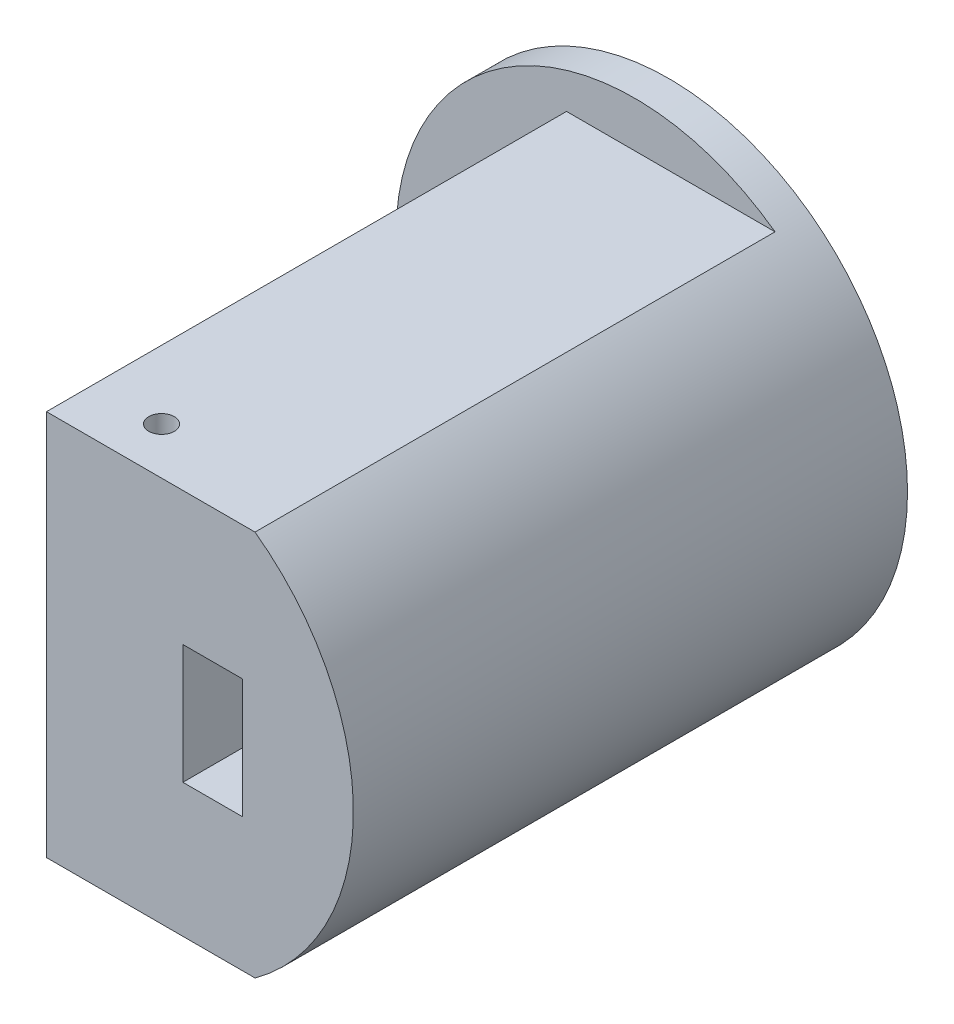
from build123d import *

# Parameters (mm, degrees)
SKETCH2_R           = 14
BOSS_EXTRUDE1_DEPTH = 2
SKETCH1_W           = 8
SKETCH1_H           = 22.649954628
SKETCH1_W_2         = 6
SKETCH1_H_2         = 18.4
BOSS_EXTRUDE2_DEPTH = 25
SKETCH3_W           = 8
SKETCH3_H           = 22.649954628
BOSS_EXTRUDE3_DEPTH = 5.5
SKETCH4_W           = 6
SKETCH4_H           = 18.4
CUT_EXTRUDE1_DEPTH  = 37.362755671
SKETCH5_W           = 5
SKETCH5_H           = 18.4
CUT_EXTRUDE2_DEPTH  = 40.258756985
SKETCH7_R           = 0.75
CUT_EXTRUDE3_DEPTH  = 44.515565904
BOSS_EXTRUDE4_DEPTH = 30.5
SKETCH9_W           = 3.5
SKETCH9_H           = 7
CUT_EXTRUDE4_DEPTH  = 6


with BuildPart() as part:
    # Sketch2 → Boss-Extrude1 (new body)
    with BuildSketch(Plane.XY):
        Circle(SKETCH2_R)
    extrude(amount=BOSS_EXTRUDE1_DEPTH)

    # Sketch1 → Boss-Extrude2 (add)
    with BuildSketch(Plane.XY.offset(2)):
        Rectangle(SKETCH1_W, SKETCH1_H)
        Rectangle(SKETCH1_W_2, SKETCH1_H_2, mode=Mode.SUBTRACT)
    extrude(amount=BOSS_EXTRUDE2_DEPTH)

    # Sketch3 → Boss-Extrude3 (add)
    with BuildSketch(Plane.XY.offset(27)):
        Rectangle(SKETCH3_W, SKETCH3_H)
    extrude(amount=BOSS_EXTRUDE3_DEPTH)

    # Sketch4 → Cut-Extrude1 (cut, through all)
    with BuildSketch(Plane.XY.offset(2)):
        Rectangle(SKETCH4_W, SKETCH4_H)
    extrude(amount=-CUT_EXTRUDE1_DEPTH, mode=Mode.SUBTRACT)

    # Sketch5 → Cut-Extrude2 (cut, through all)
    with BuildSketch(Plane.ZY.offset(-3)):
        with Locations((24.5, 0)):
            Rectangle(SKETCH5_W, SKETCH5_H)
    extrude(amount=CUT_EXTRUDE2_DEPTH, mode=Mode.SUBTRACT)

    # Sketch7 → Cut-Extrude3 (cut, through all)
    with BuildSketch(Plane(origin=(0, 11.324977314, 0), x_dir=(1, 0, 0), z_dir=(0, 1, 0))):
        with Locations(Location((0, -29.75, 0), (0, 0, 180))):
            Circle(SKETCH7_R)
    extrude(amount=-CUT_EXTRUDE3_DEPTH, mode=Mode.SUBTRACT)

    # Sketch8 → Boss-Extrude4 (add)
    with BuildSketch(Plane.XY.offset(2)):
        with BuildLine():
            Line((4, 11.324977314), (4, -11.324977314))
            Line((4, -11.324977314), (8.23072833, -11.324977314))
            ThreePointArc((8.23072833, -11.324977314), (12.474578081, -6.354911619), (14, 0))
            ThreePointArc((14, 0), (12.474578081, 6.354911619), (8.23072833, 11.324977314))
            Line((8.23072833, 11.324977314), (4, 11.324977314))
        make_face()
    extrude(amount=BOSS_EXTRUDE4_DEPTH)

    # Sketch9 → Cut-Extrude4 (cut)
    with BuildSketch(Plane.XY.offset(32.5)):
        with Locations((5.75, 0)):
            Rectangle(SKETCH9_W, SKETCH9_H)
    extrude(amount=-CUT_EXTRUDE4_DEPTH, mode=Mode.SUBTRACT)


solid = part.part
